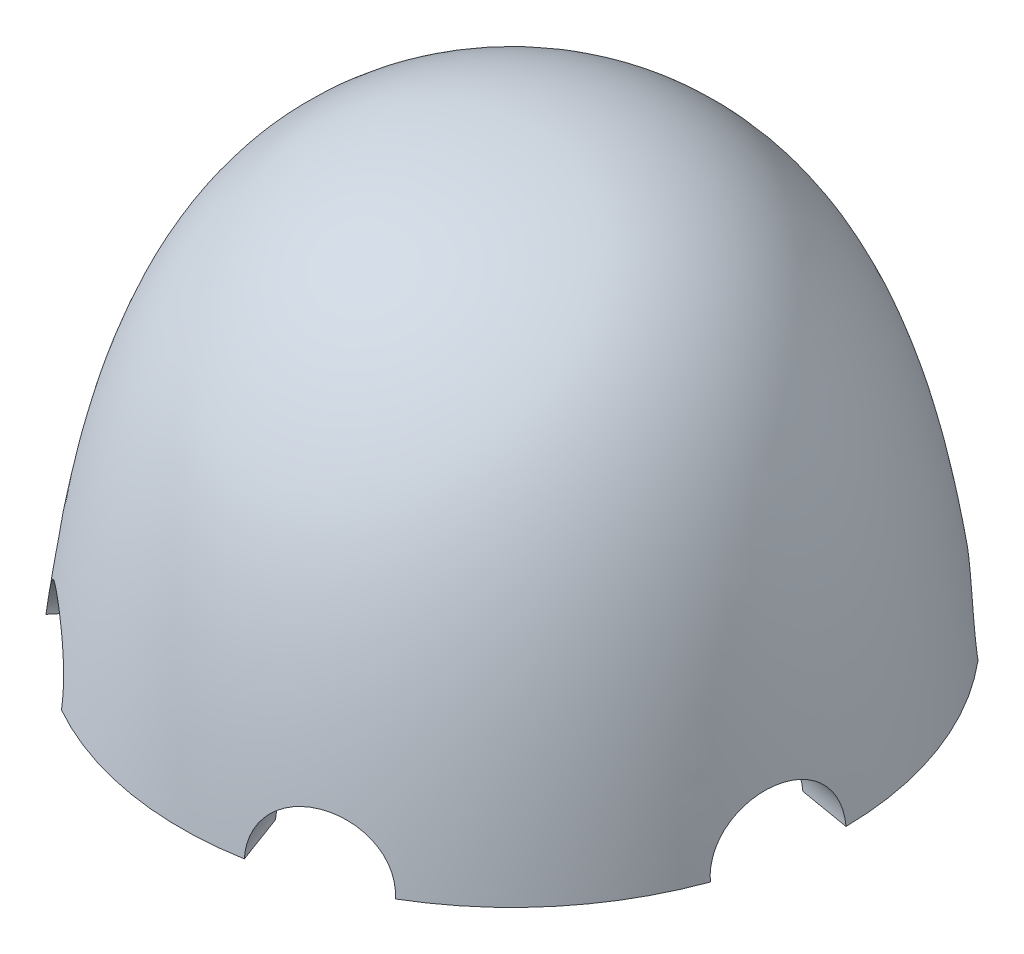
from build123d import *

# Parameters (mm, degrees)
SKETCH_2_R               = 1.651
CUT_EXTRUDE_2_DEPTH      = 91.751697814
SKETCH_3_R               = 3.175
CUT_EXTRUDE_3_DEPTH      = 26
CUT_EXTRUDE_6_DEPTH      = 171.936937112
PATTERN_CIRCULAR_1_COUNT = 3


with BuildPart() as part:
    # 草图1 → 旋转1 (revolve)
    with BuildSketch(Plane.XY):
        with BuildLine():
            Line((-57.15, 0), (-48.201934037, 0))
            add(Edge.make_bspline(
                [(-48.201934037, 0), (-47.996267093, 1.778662864), (-47.522687895, 5.659356316), (-46.359317113, 13.861065304), (-44.38586856, 24.435820868), (-40.985955974, 36.381836571), (-36.337578012, 46.932872089), (-31.338663057, 54.099865092), (-26.597509905, 58.73057135), (-22.613977153, 61.657830569), (-18.108849913, 64.039104922), (-13.81197765, 65.548303683), (-9.980690551, 66.436316246), (-6.897059853, 66.930115728), (-4.135495293, 67.186856186), (-1.818265262, 67.292050819), (-0.601290545, 67.31), (0, 67.31)],
                knots=[0.009869614, 0.009869614, 0.009869614, 0.009869614, 0.0625, 0.125, 0.25, 0.375, 0.5, 0.625, 0.6875, 0.75, 0.8125, 0.875, 0.90625, 0.9375, 0.96875, 0.984375, 1, 1, 1, 1], degree=3))
            Line((0, 67.31), (0, 76.2))
            add(Edge.make_bspline(
                [(-57.15, 0), (-53.272554224, 34.209036409), (-44.696037368, 76.2), (0, 76.2)],
                knots=[0, 0, 0, 0, 1, 1, 1, 1], degree=3))
        make_face()
    revolve(axis=Axis((0, 0, 0), (0, 1, 0)))

    # 草图2 → 切除-拉伸2 (cut, through all)
    with BuildSketch(Plane(origin=(0, 34.925, 0), x_dir=(-1, 0, 0), z_dir=(0, -1, 0))):
        with Locations((0, 53.975)):
            Circle(SKETCH_2_R)
    extrude(amount=CUT_EXTRUDE_2_DEPTH, mode=Mode.SUBTRACT)

    # 草图3 → 切除-拉伸3 (cut)
    with BuildSketch(Plane(origin=(0, 34.925, 0), x_dir=(-1, 0, 0), z_dir=(0, -1, 0))):
        with Locations((0, 53.975)):
            Circle(SKETCH_3_R)
    extrude(amount=CUT_EXTRUDE_3_DEPTH, mode=Mode.SUBTRACT)

    # 草图4 → 切除-拉伸6 (cut, through all)
    with BuildSketch(Plane(origin=(-78.631059864, 0, -13.394313695), x_dir=(0.16792488488501636, 0, -0.9857997935870925), z_dir=(0.9857997935870924, 0, 0.16792488488501633))):
        with BuildLine():
            Line((10.16, 0), (-10.16, 0))
            ThreePointArc((-10.16, 0), (0, 10.16), (10.16, 0))
        make_face()
    cut_extrude_6 = extrude(amount=CUT_EXTRUDE_6_DEPTH, mode=Mode.SUBTRACT)

    # 阵列(圆周)1: 切除-拉伸6 ×3 about axis
    pattern_circular_1_axis = Axis((0, 0, 0), (0, -1, 0))
    for i in range(1, PATTERN_CIRCULAR_1_COUNT):
        add(cut_extrude_6.rotate(pattern_circular_1_axis, i * 360 / PATTERN_CIRCULAR_1_COUNT), mode=Mode.SUBTRACT)


solid = part.part
